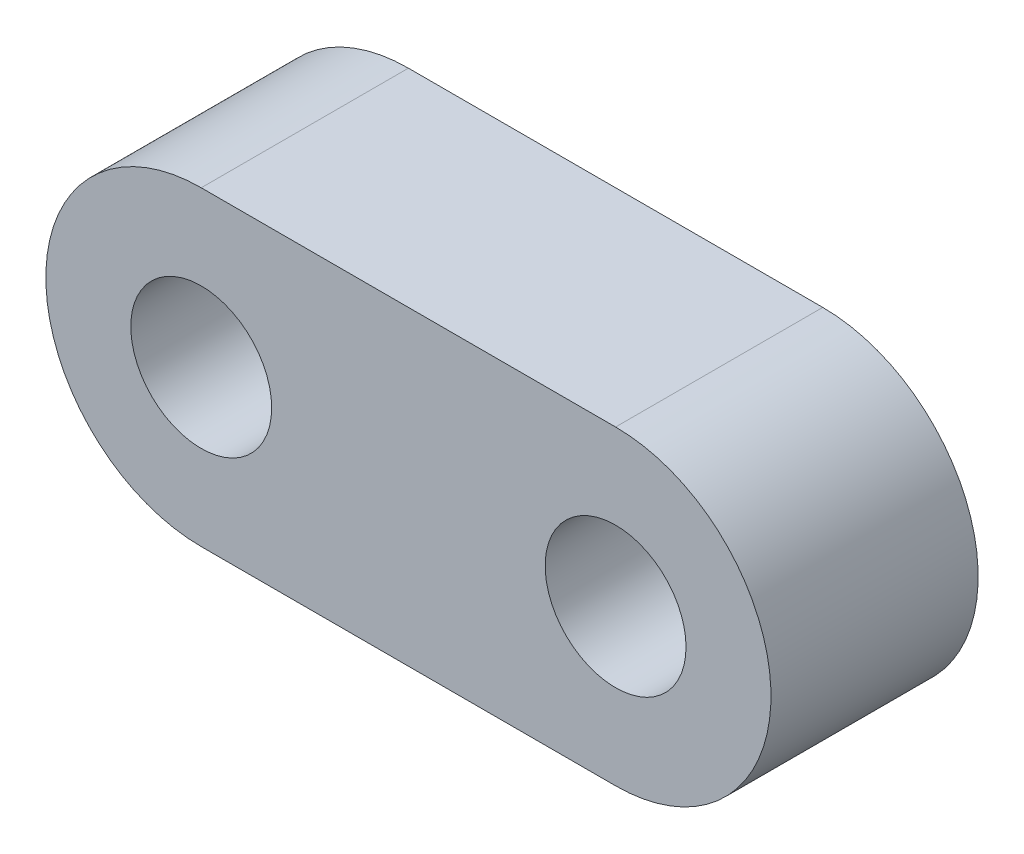
from build123d import *

# Parameters (mm, degrees)
SKETCH1_R           = 2.159
BOSS_EXTRUDE1_DEPTH = 6.35


with BuildPart() as part:
    # Sketch1 → Boss-Extrude1 (new body)
    with BuildSketch(Plane.XY):
        with BuildLine():
            Line((0, 4.7625), (12.7, 4.7625))
            ThreePointArc((12.7, 4.7625), (17.4625, 0), (12.7, -4.7625))
            Line((12.7, -4.7625), (0, -4.7625))
            ThreePointArc((0, -4.7625), (-4.7625, 0), (0, 4.7625))
        make_face()
        with Locations((12.7, 0)):
            Circle(SKETCH1_R, mode=Mode.SUBTRACT)
        Circle(SKETCH1_R, mode=Mode.SUBTRACT)
    extrude(amount=BOSS_EXTRUDE1_DEPTH)


solid = part.part
